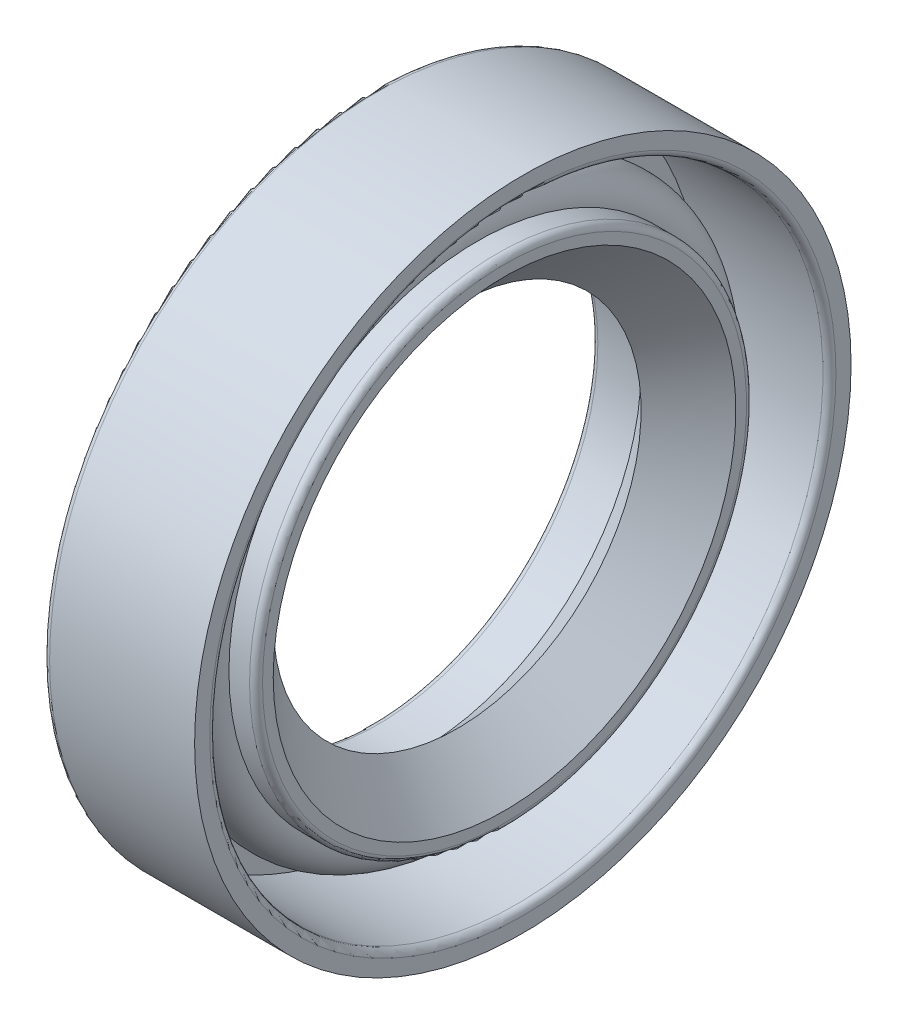
from build123d import *


with BuildPart() as part:
    # Çizim1 → Döndür1 (revolve)
    with BuildSketch(Plane.XY, mode=Mode.PRIVATE) as d_nd_r1_sk:
        with BuildLine():
            Line((7, 15.167162356), (0.3, 15.167162356))
            ThreePointArc((0.3, 15.167162356), (0.087867966, 15.079294391), (0, 14.867162356))
            Line((0, 14.867162356), (0, 10.467162356))
            ThreePointArc((0, 10.467162356), (0.087867966, 10.255030322), (0.3, 10.167162356))
            Line((0.3, 10.167162356), (2.297581493, 10.167162356))
            Line((2.297581493, 10.167162356), (3.96474385, 8.5))
            Line((3.96474385, 8.5), (6.153966129, 10.689222279))
            Line((6.153966129, 10.689222279), (6.153966129, 11.182619933))
            ThreePointArc((6.153966129, 11.182619933), (6.066098163, 11.394751968), (5.853966129, 11.482619933))
            Line((5.853966129, 11.482619933), (4.901824756, 11.482619933))
            ThreePointArc((4.901824756, 11.482619933), (3.691974336, 12.877012776), (2.297581493, 11.667162356))
            Line((2.297581493, 11.667162356), (1, 11.667162356))
            Line((1, 11.667162356), (1, 14.167162356))
            Line((1, 14.167162356), (6.7, 14.167162356))
            ThreePointArc((6.7, 14.167162356), (6.912132034, 14.255030322), (7, 14.467162356))
            Line((7, 14.467162356), (7, 15.167162356))
        make_face()
    revolve(d_nd_r1_sk.sketch.rotate(Axis((0, 0, 0), (1, 0, 0)), 90), axis=Axis((0, 0, 0), (1, 0, 0)))


solid = part.part
